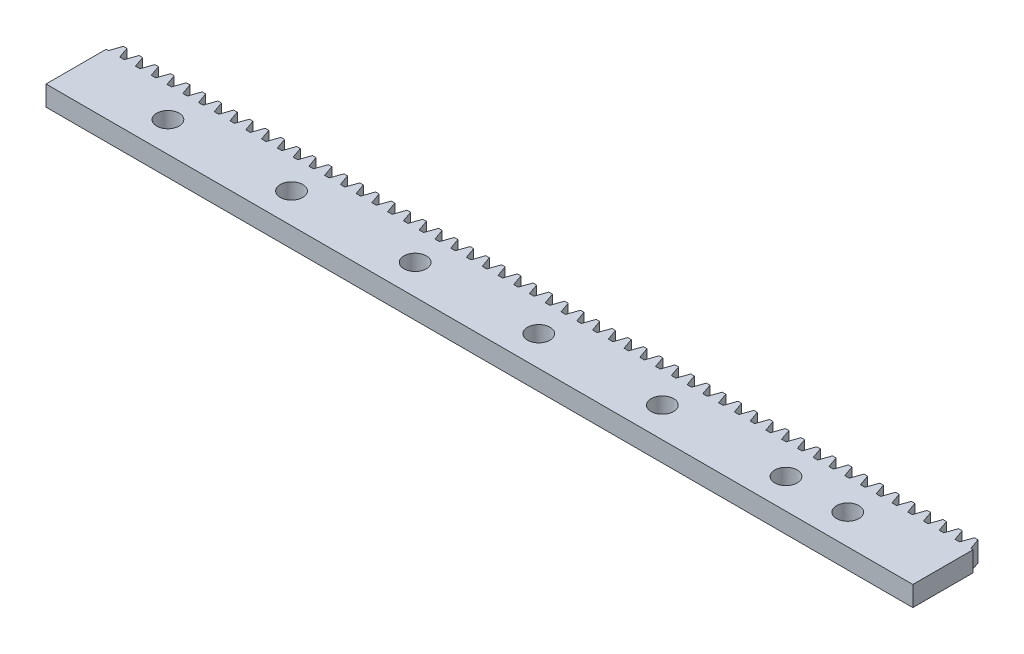
from build123d import *

# Parameters (mm, degrees)
SKETCH1_R           = 1.778
BOSS_EXTRUDE1_DEPTH = 3.175


with BuildPart() as part:
    # Sketch1 → Boss-Extrude1 (new body)
    with BuildSketch(Plane.XZ):
        Polygon((14.606788287, -4.7625), (15.316881609, -4.7625), (15.926300331, -6.511544), (16.491008723, -6.511544), (17.100427445, -4.7625), (17.810520767, -4.7625), (18.419939489, -6.511544), (18.984647881, -6.511544), (19.594066603, -4.7625), (19.949113264, -4.7625), (19.949113264, 4.7625), (-117.203516291, 4.7625), (-117.203516291, -4.7625), (-116.845993765, -4.7625), (-116.236575043, -6.511544), (-115.671866651, -6.511544), (-115.062447929, -4.7625), (-114.352354607, -4.7625), (-113.742935885, -6.511544), (-113.178227493, -6.511544), (-112.568808771, -4.7625), (-111.858715449, -4.7625), (-111.249296727, -6.511544), (-110.684588335, -6.511544), (-110.075169613, -4.7625), (-109.365076291, -4.7625), (-108.755657569, -6.511544), (-108.190949177, -6.511544), (-107.581530455, -4.7625), (-106.871437133, -4.7625), (-106.262018411, -6.511544), (-105.697310019, -6.511544), (-105.087891297, -4.7625), (-104.377797975, -4.7625), (-103.768379253, -6.511544), (-103.203670861, -6.511544), (-102.594252139, -4.7625), (-101.884158817, -4.7625), (-101.274740095, -6.511544), (-100.710031703, -6.511544), (-100.100612981, -4.7625), (-99.390519659, -4.7625), (-98.781100937, -6.511544), (-98.216392545, -6.511544), (-97.606973823, -4.7625), (-96.896880501, -4.7625), (-96.287461779, -6.511544), (-95.722753387, -6.511544), (-95.113334665, -4.7625), (-94.403241343, -4.7625), (-93.793822621, -6.511544), (-93.229114229, -6.511544), (-92.619695507, -4.7625), (-91.909602185, -4.7625), (-91.300183463, -6.511544), (-90.735475071, -6.511544), (-90.126056349, -4.7625), (-89.415963027, -4.7625), (-88.806544305, -6.511544), (-88.241835913, -6.511544), (-87.632417191, -4.7625), (-86.922323869, -4.7625), (-86.312905147, -6.511544), (-85.748196755, -6.511544), (-85.138778033, -4.7625), (-84.428684711, -4.7625), (-83.819265989, -6.511544), (-83.254557597, -6.511544), (-82.645138875, -4.7625), (-81.935045553, -4.7625), (-81.325626831, -6.511544), (-80.760918439, -6.511544), (-80.151499717, -4.7625), (-79.441406395, -4.7625), (-78.831987673, -6.511544), (-78.267279281, -6.511544), (-77.657860559, -4.7625), (-76.947767237, -4.7625), (-76.338348515, -6.511544), (-75.773640123, -6.511544), (-75.164221401, -4.7625), (-74.454128079, -4.7625), (-73.844709357, -6.511544), (-73.280000965, -6.511544), (-72.670582243, -4.7625), (-71.960488921, -4.7625), (-71.351070199, -6.511544), (-70.786361807, -6.511544), (-70.176943085, -4.7625), (-69.466849763, -4.7625), (-68.857431041, -6.511544), (-68.292722649, -6.511544), (-67.683303927, -4.7625), (-66.973210605, -4.7625), (-66.363791883, -6.511544), (-65.799083491, -6.511544), (-65.189664769, -4.7625), (-64.479571447, -4.7625), (-63.870152725, -6.511544), (-63.305444333, -6.511544), (-62.696025611, -4.7625), (-61.985932289, -4.7625), (-61.376513567, -6.511544), (-60.811805175, -6.511544), (-60.202386453, -4.7625), (-59.492293131, -4.7625), (-58.882874409, -6.511544), (-58.318166017, -6.511544), (-57.708747295, -4.7625), (-56.998653973, -4.7625), (-56.389235251, -6.511544), (-55.824526859, -6.511544), (-55.215108137, -4.7625), (-54.505014815, -4.7625), (-53.895596093, -6.511544), (-53.330887701, -6.511544), (-52.721468979, -4.7625), (-52.011375657, -4.7625), (-51.401956935, -6.511544), (-50.837248543, -6.511544), (-50.227829821, -4.7625), (-49.517736499, -4.7625), (-48.908317777, -6.511544), (-48.343609385, -6.511544), (-47.734190663, -4.7625), (-47.024097341, -4.7625), (-46.414678619, -6.511544), (-45.849970227, -6.511544), (-45.240551505, -4.7625), (-44.530458183, -4.7625), (-43.921039461, -6.511544), (-43.356331069, -6.511544), (-42.746912347, -4.7625), (-42.036819025, -4.7625), (-41.427400303, -6.511544), (-40.862691911, -6.511544), (-40.253273189, -4.7625), (-39.543179867, -4.7625), (-38.933761145, -6.511544), (-38.369052753, -6.511544), (-37.759634031, -4.7625), (-37.049540709, -4.7625), (-36.440121987, -6.511544), (-35.875413595, -6.511544), (-35.265994873, -4.7625), (-34.555901551, -4.7625), (-33.946482829, -6.511544), (-33.381774437, -6.511544), (-32.772355715, -4.7625), (-32.062262393, -4.7625), (-31.452843671, -6.511544), (-30.888135279, -6.511544), (-30.278716557, -4.7625), (-29.568623235, -4.7625), (-28.959204513, -6.511544), (-28.394496121, -6.511544), (-27.785077399, -4.7625), (-27.074984077, -4.7625), (-26.465565355, -6.511544), (-25.900856963, -6.511544), (-25.291438241, -4.7625), (-24.581344919, -4.7625), (-23.971926197, -6.511544), (-23.407217805, -6.511544), (-22.797799083, -4.7625), (-22.087705761, -4.7625), (-21.478287039, -6.511544), (-20.913578647, -6.511544), (-20.304159925, -4.7625), (-19.594066603, -4.7625), (-18.984647881, -6.511544), (-18.419939489, -6.511544), (-17.810520767, -4.7625), (-17.100427445, -4.7625), (-16.491008723, -6.511544), (-15.926300331, -6.511544), (-15.316881609, -4.7625), (-14.606788287, -4.7625), (-13.997369565, -6.511544), (-13.432661173, -6.511544), (-12.823242451, -4.7625), (-12.113149129, -4.7625), (-11.503730407, -6.511544), (-10.939022015, -6.511544), (-10.329603293, -4.7625), (-9.619509971, -4.7625), (-9.010091249, -6.511544), (-8.445382857, -6.511544), (-7.835964135, -4.7625), (-7.125870813, -4.7625), (-6.516452091, -6.511544), (-5.951743699, -6.511544), (-5.342324977, -4.7625), (-4.632231655, -4.7625), (-4.022812933, -6.511544), (-3.458104541, -6.511544), (-2.848685819, -4.7625), (-2.138592497, -4.7625), (-1.529173775, -6.511544), (-0.964465383, -6.511544), (-0.355046661, -4.7625), (0.355046661, -4.7625), (0.964465383, -6.511544), (1.529173775, -6.511544), (2.138592497, -4.7625), (2.848685819, -4.7625), (3.458104541, -6.511544), (4.022812933, -6.511544), (4.632231655, -4.7625), (5.342324977, -4.7625), (5.951743699, -6.511544), (6.516452091, -6.511544), (7.125870813, -4.7625), (7.835964135, -4.7625), (8.445382857, -6.511544), (9.010091249, -6.511544), (9.619509971, -4.7625), (10.329603293, -4.7625), (10.939022015, -6.511544), (11.503730407, -6.511544), (12.113149129, -4.7625), (12.823242451, -4.7625), (13.432661173, -6.511544), (13.997369565, -6.511544), align=None)
        with Locations(Location((4.88696, 0, 0), (0, 0, 90))):
            Circle(SKETCH1_R, mode=Mode.SUBTRACT)
        with Locations(Location((-102.67696, 0, 0), (0, 0, 90))):
            Circle(SKETCH1_R, mode=Mode.SUBTRACT)
        with Locations(Location((-83.11896, 0, 0), (0, 0, 90))):
            Circle(SKETCH1_R, mode=Mode.SUBTRACT)
        with Locations(Location((-63.56096, 0, 0), (0, 0, 90))):
            Circle(SKETCH1_R, mode=Mode.SUBTRACT)
        with Locations(Location((-44.00296, 0, 0), (0, 0, 90))):
            Circle(SKETCH1_R, mode=Mode.SUBTRACT)
        with Locations(Location((-24.44496, 0, 0), (0, 0, 90))):
            Circle(SKETCH1_R, mode=Mode.SUBTRACT)
        with Locations(Location((-4.88696, 0, 0), (0, 0, 90))):
            Circle(SKETCH1_R, mode=Mode.SUBTRACT)
    extrude(amount=-BOSS_EXTRUDE1_DEPTH)


solid = part.part
